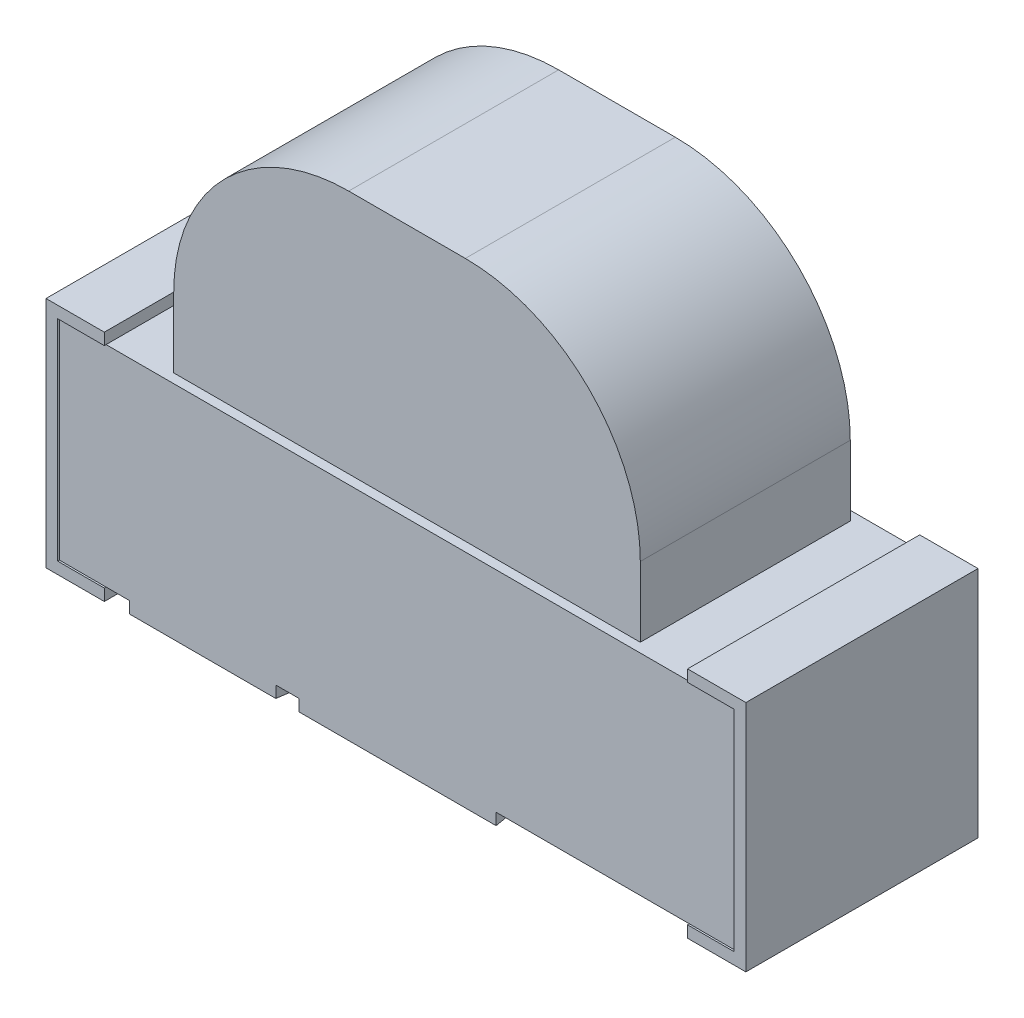
from build123d import *

# Parameters (mm, degrees)
SKIZZE1_W                       = 2.9
SKIZZE1_H                       = 0.98
LINEAR_AUSTRAGEN1_DEPTH         = 0.9
LINEAR_AUSTRAGEN2_DEPTH         = 0.45
SKIZZE5_W                       = 3
SKIZZE5_H                       = 1.08
SKIZZE5_W_2                     = 2.9
SKIZZE5_H_2                     = 0.98
LINEAR_AUSTRAGEN6_DEPTH         = 0.9
SKIZZE6_W                       = 0.25
SKIZZE6_H                       = 1.08
LINEAR_AUSTRAGEN7_DEPTH         = 0.05
SKIZZE7_W                       = 0.25
SKIZZE7_H                       = 1.08
LINEAR_AUSTRAGEN8_DEPTH         = 0.05
LINEAR_AUSTRAGEN9_DEPTH         = 0.05
SCHNITT_LINEAR_AUSTRAGEN2_DEPTH = 0.05
SKIZZE10_W                      = 3
SKIZZE10_H                      = 1
SCHNITT_LINEAR_AUSTRAGEN3_DEPTH = 0.0425


with BuildPart() as part:
    # Skizze1 → Linear austragen1 (new body)
    with BuildSketch(Plane(origin=(0, 0, 0), x_dir=(1, 0, 0), z_dir=(0, 1, 0))):
        Rectangle(SKIZZE1_W, SKIZZE1_H)
    extrude(amount=LINEAR_AUSTRAGEN1_DEPTH)



with BuildPart() as body_2:
    # Skizze2 → Linear austragen2 (new, symmetric)
    with BuildSketch(Plane.XY):
        with BuildLine():
            Line((-1, 0.9), (1, 0.9))
            Line((1, 0.9), (1, 1.2))
            ThreePointArc((1, 1.2), (0.780330086, 1.730330086), (0.25, 1.95))
            Line((0.25, 1.95), (-0.25, 1.95))
            ThreePointArc((-0.25, 1.95), (-0.780330086, 1.730330086), (-1, 1.2))
            Line((-1, 1.2), (-1, 0.9))
        make_face()
    extrude(amount=LINEAR_AUSTRAGEN2_DEPTH, both=True)


with BuildPart() as body_3:
    # Skizze5 → Linear austragen6 (new body)
    with BuildSketch(Plane(origin=(0, 0.9, 0), x_dir=(1, 0, 0), z_dir=(0, 1, 0))):
        Rectangle(SKIZZE5_W, SKIZZE5_H)
        Rectangle(SKIZZE5_W_2, SKIZZE5_H_2, mode=Mode.SUBTRACT)
    extrude(amount=-LINEAR_AUSTRAGEN6_DEPTH)


with BuildPart() as part_1:
    add(part.part)

    add(body_3.part)  # Linear austragen7 merges body 3
    # Skizze6 → Linear austragen7 (add)
    with BuildSketch(Plane(origin=(0, 0.9, 0), x_dir=(1, 0, 0), z_dir=(0, 1, 0))):
        with Locations((1.375, 0)):
            Rectangle(SKIZZE6_W, SKIZZE6_H)
        with Locations((-1.375, 0)):
            Rectangle(SKIZZE6_W, SKIZZE6_H)
    extrude(amount=LINEAR_AUSTRAGEN7_DEPTH)

    # Skizze7 → Linear austragen8 (add)
    with BuildSketch(Plane.XZ):
        with Locations((1.375, 0)):
            Rectangle(SKIZZE7_W, SKIZZE7_H)
        with Locations((-1.375, 0)):
            Rectangle(SKIZZE7_W, SKIZZE7_H)
    extrude(amount=LINEAR_AUSTRAGEN8_DEPTH)

    # Skizze8 → Linear austragen9 (add)
    with BuildSketch(Plane.XZ):
        with BuildLine():
            Line((-0.125, 0.13379808), (-0.125, -0.13379808))
            ThreePointArc((-0.125, -0.13379808), (-0.341869858, -0.287512377), (-0.425, -0.54))
            Line((-0.425, -0.54), (0.425, -0.54))
            ThreePointArc((0.425, -0.54), (0.341869858, -0.287512377), (0.125, -0.13379808))
            Line((0.125, -0.13379808), (0.125, 0.13379808))
            ThreePointArc((0.125, 0.13379808), (0.341869858, 0.287512377), (0.425, 0.54))
            Line((0.425, 0.54), (-0.425, 0.54))
            ThreePointArc((-0.425, 0.54), (-0.341869858, 0.287512377), (-0.125, 0.13379808))
        make_face()
        with BuildLine():
            Line((-0.225, 0.065658351), (-0.225, -0.065658351))
            ThreePointArc((-0.225, -0.065658351), (-0.443705984, -0.259375696), (-0.525, -0.54))
            Line((-0.525, -0.54), (-1.15, -0.54))
            Line((-1.15, -0.54), (-1.15, 0.54))
            Line((-1.15, 0.54), (-0.525, 0.54))
            ThreePointArc((-0.525, 0.54), (-0.443705984, 0.259375696), (-0.225, 0.065658351))
        make_face()
    extrude(amount=LINEAR_AUSTRAGEN9_DEPTH)

    # Skizze9 → Schnitt-Linear austragen2 (cut)
    with BuildSketch(Plane.XY.offset(0.54)):
        Polygon((-1.45, 0.9), (-1.45, 0), (-1.25, 0), (-1.25, -0.05), (1.25, -0.05), (1.25, 0), (1.449568933, 0), (1.449568933, 0.9), align=None)
    schnitt_linear_austragen2 = extrude(amount=-SCHNITT_LINEAR_AUSTRAGEN2_DEPTH, mode=Mode.SUBTRACT)

    # Spiegeln1: Schnitt-Linear austragen2 across plane
    add(schnitt_linear_austragen2.mirror(Plane.XY), mode=Mode.SUBTRACT)

    # Skizze10 → Schnitt-Linear austragen3 (cut)
    with BuildSketch(Plane.XY.offset(0.54)):
        with Locations((0, 0.45)):
            Rectangle(SKIZZE10_W, SKIZZE10_H)
    schnitt_linear_austragen3 = extrude(amount=-SCHNITT_LINEAR_AUSTRAGEN3_DEPTH, mode=Mode.SUBTRACT)

    # Spiegeln2: Schnitt-Linear austragen3 across plane
    add(schnitt_linear_austragen3.mirror(Plane.XY), mode=Mode.SUBTRACT)


solid = Compound([body_2.part, part_1.part])
